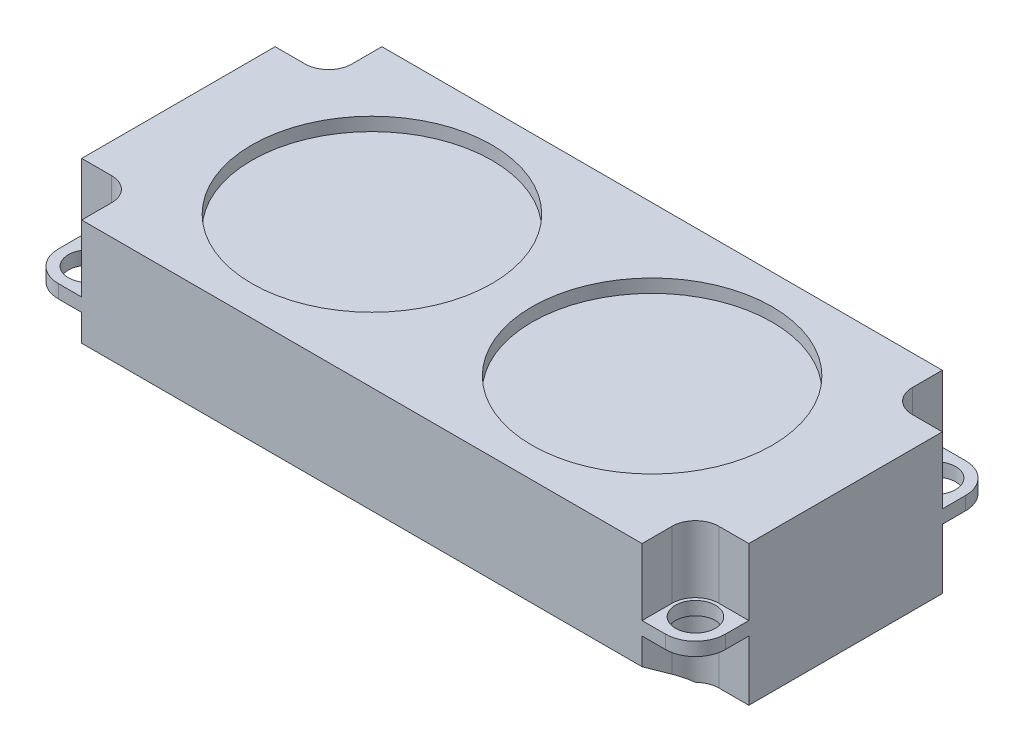
from build123d import *

# Parameters (mm, degrees)
SKETCH1_W           = 100
SKETCH1_H           = 45
BOSS_EXTRUDE1_DEPTH = 21
CUT_EXTRUDE1_DEPTH  = 105.629106849
CUT_EXTRUDE2_DEPTH  = 10
CUT_EXTRUDE3_DEPTH  = 57.127087934
SKETCH6_R           = 3
CUT_EXTRUDE4_DEPTH  = 56.921820428
FILLET1_R           = 4.5
SKETCH7_R           = 18
CUT_EXTRUDE5_DEPTH  = 2


with BuildPart() as part:
    # Sketch1 → Boss-Extrude1 (new body)
    with BuildSketch(Plane(origin=(0, 0, 0), x_dir=(1, 0, 0), z_dir=(0, 1, 0))):
        Rectangle(SKETCH1_W, SKETCH1_H)
    extrude(amount=BOSS_EXTRUDE1_DEPTH)

    # Sketch2 → Cut-Extrude1 (cut, through all)
    with BuildSketch(Plane(origin=(50, 0, 0), x_dir=(0, 0, -1), z_dir=(1, 0, 0))):
        Polygon((-22.5, 0), (-22.5, 5), (-15.5, 0), align=None)
        Polygon((22.5, 0), (15.5, 0), (22.5, 5), align=None)
    extrude(amount=-CUT_EXTRUDE1_DEPTH, mode=Mode.SUBTRACT)

    # Sketch3 → Cut-Extrude2 (cut)
    with BuildSketch(Plane(origin=(0, 21, 0), x_dir=(1, 0, 0), z_dir=(0, 1, 0))):
        with BuildLine():
            Line((-42, 22.5), (-42, 18))
            ThreePointArc((-42, 18), (-43.025126266, 15.525126266), (-45.5, 14.5))
            Line((-45.5, 14.5), (-50, 14.5))
            Line((-50, 14.5), (-50, 22.5))
            Line((-50, 22.5), (-42, 22.5))
        make_face()
        with BuildLine():
            Line((-50, -22.5), (-42, -22.5))
            Line((-42, -22.5), (-42, -18))
            ThreePointArc((-42, -18), (-43.025126266, -15.525126266), (-45.5, -14.5))
            Line((-45.5, -14.5), (-50, -14.5))
            Line((-50, -14.5), (-50, -22.5))
        make_face()
        with BuildLine():
            Line((42, -22.5), (42, -18))
            ThreePointArc((42, -18), (43.025126266, -15.525126266), (45.5, -14.5))
            Line((45.5, -14.5), (50, -14.5))
            Line((50, -14.5), (50, -22.5))
            Line((50, -22.5), (42, -22.5))
        make_face()
        with BuildLine():
            Line((50, 22.5), (42, 22.5))
            Line((42, 22.5), (42, 18))
            ThreePointArc((42, 18), (43.025126266, 15.525126266), (45.5, 14.5))
            Line((45.5, 14.5), (50, 14.5))
            Line((50, 14.5), (50, 22.5))
        make_face()
    extrude(amount=-CUT_EXTRUDE2_DEPTH, mode=Mode.SUBTRACT)

    # Sketch5 → Cut-Extrude3 (cut, through all)
    with BuildSketch(Plane(origin=(0, 9, 0), x_dir=(1, 0, 0), z_dir=(0, 1, 0))):
        with BuildLine():
            Line((-45.5, -14.5), (-50, -14.5))
            Line((-50, -14.5), (-50, -22.5))
            Line((-50, -22.5), (-42, -22.5))
            Line((-42, -22.5), (-42, -18))
            ThreePointArc((-42, -18), (-43.025126266, -15.525126266), (-45.5, -14.5))
        make_face()
        with BuildLine():
            Line((42, -18), (42, -22.5))
            Line((42, -22.5), (50, -22.5))
            Line((50, -22.5), (50, -14.5))
            Line((50, -14.5), (45.5, -14.5))
            ThreePointArc((45.5, -14.5), (43.025126266, -15.525126266), (42, -18))
        make_face()
        with BuildLine():
            Line((45.5, 14.5), (50, 14.5))
            Line((50, 14.5), (50, 22.5))
            Line((50, 22.5), (42, 22.5))
            Line((42, 22.5), (42, 18))
            ThreePointArc((42, 18), (43.025126266, 15.525126266), (45.5, 14.5))
        make_face()
        with BuildLine():
            Line((-42, 22.5), (-50, 22.5))
            Line((-50, 22.5), (-50, 14.5))
            Line((-50, 14.5), (-45.5, 14.5))
            ThreePointArc((-45.5, 14.5), (-43.025126266, 15.525126266), (-42, 18))
            Line((-42, 18), (-42, 22.5))
        make_face()
    extrude(amount=-CUT_EXTRUDE3_DEPTH, mode=Mode.SUBTRACT)

    # Sketch6 → Cut-Extrude4 (cut, through all)
    with BuildSketch(Plane(origin=(0, 11, 0), x_dir=(1, 0, 0), z_dir=(0, 1, 0))):
        with Locations(Location((-45.5, 18, 0), (0, 0, 270))):
            Circle(SKETCH6_R)
        with Locations(Location((-45.5, -18, 0), (0, 0, 270))):
            Circle(SKETCH6_R)
        with Locations(Location((45.5, -18, 0), (0, 0, 270))):
            Circle(SKETCH6_R)
        with Locations(Location((45.5, 18, 0), (0, 0, 270))):
            Circle(SKETCH6_R)
    extrude(amount=-CUT_EXTRUDE4_DEPTH, mode=Mode.SUBTRACT)

    # Fillet1
    fillet1_edges = [part.edges().sort_by_distance(p)[0] for p in [
        (-50, 10, 22.5),
        (50, 10, 22.5),
        (-50, 10, -22.5),
        (50, 10, -22.5),
    ]]
    fillet(fillet1_edges, radius=FILLET1_R)

    # Sketch7 → Cut-Extrude5 (cut)
    with BuildSketch(Plane(origin=(0, 21, 0), x_dir=(1, 0, 0), z_dir=(0, 1, 0))):
        with Locations(Location((-21, 0, 0), (0, 0, 270))):
            Circle(SKETCH7_R)
        with Locations(Location((21, 0, 0), (0, 0, 270))):
            Circle(SKETCH7_R)
    extrude(amount=-CUT_EXTRUDE5_DEPTH, mode=Mode.SUBTRACT)


solid = part.part
